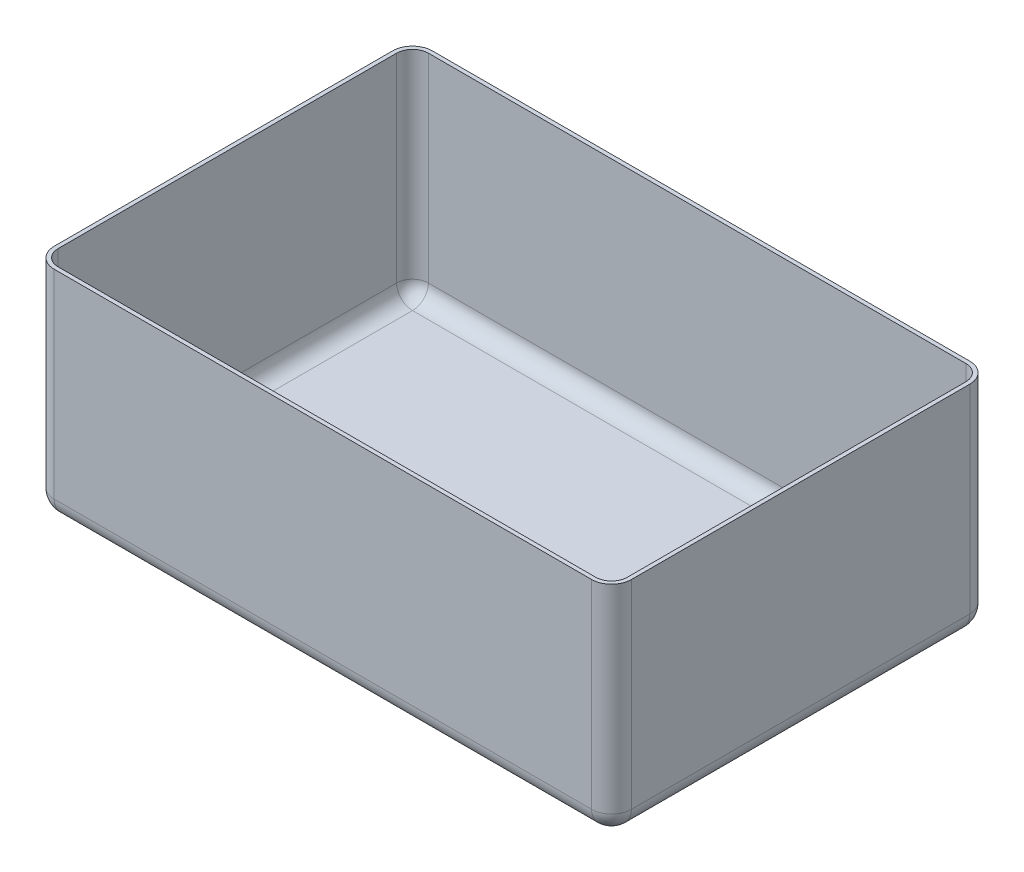
from build123d import *

# Parameters (mm, degrees)
SKETCH1_W           = 368.3
SKETCH1_H           = 241.3
BOSS_EXTRUDE1_DEPTH = 139.7
FILLET1_R           = 12.7
SHELL1_T            = -2.54


with BuildPart() as part:
    # Sketch1 → Boss-Extrude1 (new body)
    with BuildSketch(Plane(origin=(0, 0, 0), x_dir=(1, 0, 0), z_dir=(0, 1, 0))):
        Rectangle(SKETCH1_W, SKETCH1_H)
    extrude(amount=BOSS_EXTRUDE1_DEPTH)

    # Fillet1
    fillet1_edges = [part.edges().sort_by_distance(p)[0] for p in [
        (0, 0, 120.65),
        (-184.15, 0, 0),
        (0, 0, -120.65),
        (184.15, 0, 0),
        (184.15, 69.85, 120.65),
        (-184.15, 69.85, 120.65),
        (-184.15, 69.85, -120.65),
        (184.15, 69.85, -120.65),
    ]]
    fillet(fillet1_edges, radius=FILLET1_R)

    # Shell1
    shell1_openings = [part.faces().sort_by_distance(p)[0] for p in [
        (0, 139.7, 0),
    ]]
    offset(amount=SHELL1_T, openings=shell1_openings, kind=Kind.INTERSECTION)


solid = part.part
